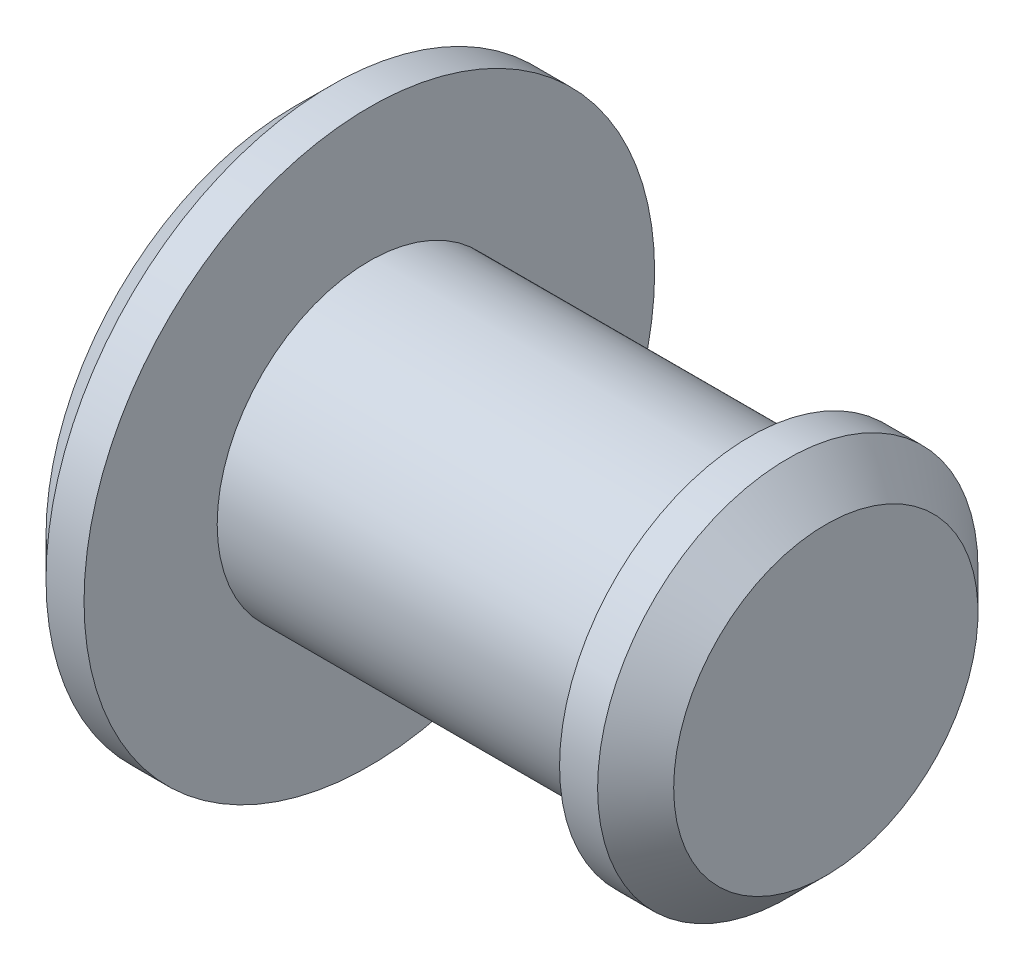
from build123d import *

# Parameters (mm, degrees)
SMUSSO1_SIZE = 0.5


with BuildPart() as part:
    # Schizzo1 → Rivoluzione1 (revolve)
    with BuildSketch(Plane.XY, mode=Mode.PRIVATE) as rivoluzione1_sk:
        Polygon((0, 0), (0, 3.75), (1, 3.75), (1, 2), (6, 2), (6, 2.5), (7, 2.5), (7, 0), align=None)
    revolve(rivoluzione1_sk.sketch.rotate(Axis((-5.173483989, 0, 0), (1, 0, 0)), 90), axis=Axis((-5.173483989, 0, 0), (1, 0, 0)))

    # Smusso1
    smusso1_edges = [part.edges().sort_by_distance(p)[0] for p in [
        (7, 0, -2.5),
        (0, 0, -3.75),
    ]]
    chamfer(smusso1_edges, length=SMUSSO1_SIZE)


solid = part.part
